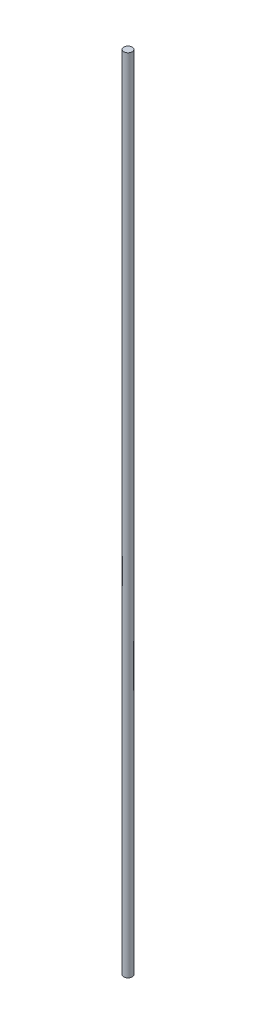
from build123d import *

# Parameters (mm, degrees)
SKETCH1_R           = 4.7625
BOSS_EXTRUDE1_DEPTH = 457.2


with BuildPart() as part:
    # Sketch1 → Boss-Extrude1 (new, symmetric)
    with BuildSketch(Plane(origin=(0, 0, 0), x_dir=(1, 0, 0), z_dir=(0, 1, 0))):
        with Locations(Location((0, 0, 0), (0, 0, 270))):
            Circle(SKETCH1_R)
    extrude(amount=BOSS_EXTRUDE1_DEPTH, both=True)


solid = part.part
